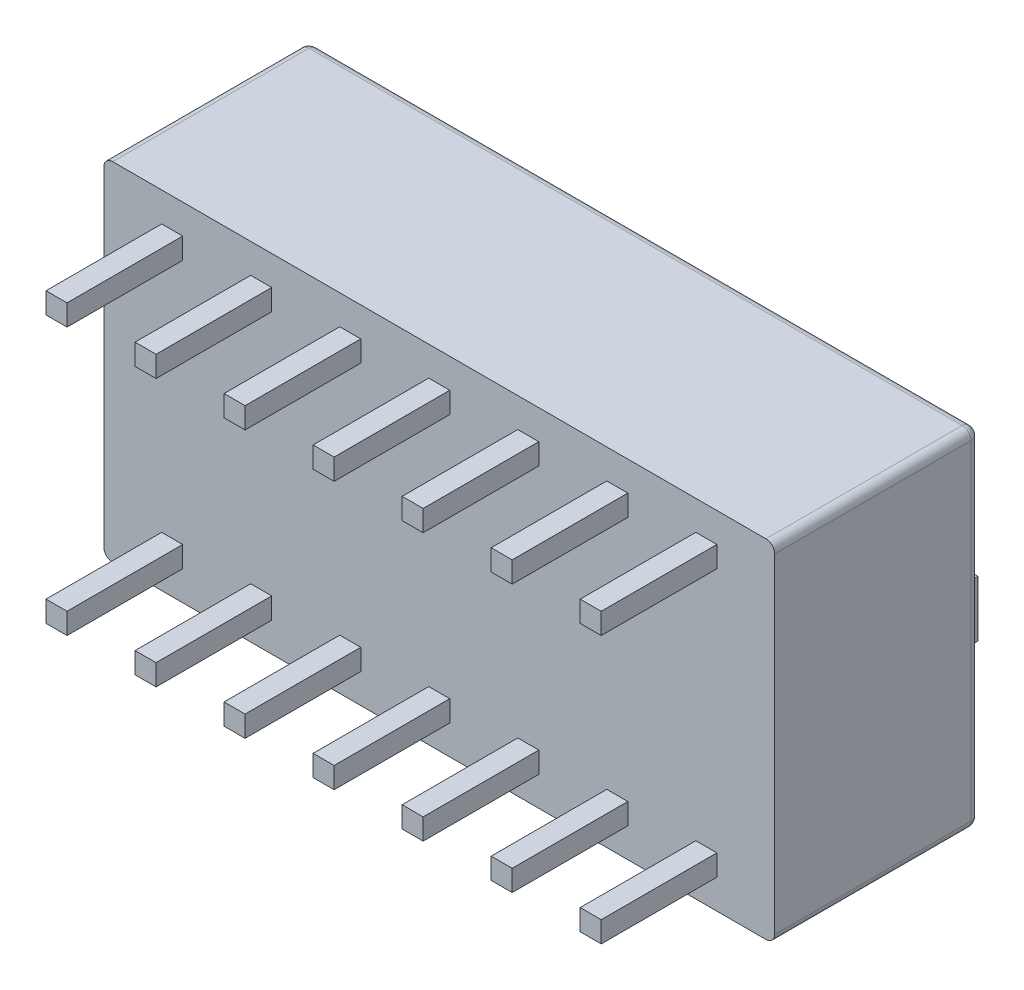
from build123d import *

# Parameters (mm, degrees)
IZIM1_W                       = 19.14
IZIM1_H                       = 9.9
Y_KSEKLIK_EKSTR_ZYON1_DEPTH   = 5.85
IZIM2_W                       = 1.4
IZIM2_H                       = 3.2
KES_EKSTR_ZYON1_DEPTH         = 1
IZIM3_W                       = 1.4
IZIM3_H                       = 1.6
Y_KSEKLIK_EKSTR_ZYON2_DEPTH   = 2.2
Y_KSEKLIK_EKSTR_ZYON2_2_DEPTH = 2.2
Y_KSEKLIK_EKSTR_ZYON2_3_DEPTH = 2.2
Y_KSEKLIK_EKSTR_ZYON2_4_DEPTH = 2.2
Y_KSEKLIK_EKSTR_ZYON2_5_DEPTH = 2.2
Y_KSEKLIK_EKSTR_ZYON2_6_DEPTH = 2.2
Y_KSEKLIK_EKSTR_ZYON2_7_DEPTH = 2.2
IZIM4_W                       = 1.4
IZIM4_H                       = 1.6
Y_KSEKLIK_EKSTR_ZYON3_DEPTH   = 0.9
Y_KSEKLIK_EKSTR_ZYON3_2_DEPTH = 0.9
Y_KSEKLIK_EKSTR_ZYON3_3_DEPTH = 0.9
Y_KSEKLIK_EKSTR_ZYON3_4_DEPTH = 0.9
Y_KSEKLIK_EKSTR_ZYON3_5_DEPTH = 0.9
Y_KSEKLIK_EKSTR_ZYON3_6_DEPTH = 0.9
Y_KSEKLIK_EKSTR_ZYON3_7_DEPTH = 0.9
RADYUS1_R                     = 0.25
IZIM5_W                       = 0.6
IZIM5_H                       = 0.6
Y_KSEKLIK_EKSTR_ZYON4_DEPTH   = 3.3


with BuildPart() as part:
    # Çizim1 → Yükseklik-Ekstrüzyon1 (new body)
    with BuildSketch(Plane.XY):
        Rectangle(IZIM1_W, IZIM1_H)
    extrude(amount=Y_KSEKLIK_EKSTR_ZYON1_DEPTH)

    # Çizim2 → Kes-Ekstrüzyon1 (cut)
    with BuildSketch(Plane(origin=(0, 0, 0), x_dir=(-1, 0, 0), z_dir=(0, 0, -1))):
        with Locations((-7.62, 0)):
            Rectangle(IZIM2_W, IZIM2_H)
        with Locations((-5.08, 0)):
            Rectangle(IZIM2_W, IZIM2_H)
        with Locations((-2.54, 0)):
            Rectangle(IZIM2_W, IZIM2_H)
        Rectangle(IZIM2_W, IZIM2_H)
        with Locations((2.54, 0)):
            Rectangle(IZIM2_W, IZIM2_H)
        with Locations((5.08, 0)):
            Rectangle(IZIM2_W, IZIM2_H)
        with Locations((7.62, 0)):
            Rectangle(IZIM2_W, IZIM2_H)
    extrude(amount=-KES_EKSTR_ZYON1_DEPTH, mode=Mode.SUBTRACT)

    # Radyus1
    radyus1_edges = [part.edges().sort_by_distance(p)[0] for p in [
        (0, -4.95, 0),
        (-9.57, 0, 0),
        (0, 4.95, 0),
        (9.57, 0, 0),
        (9.57, -4.95, 2.925),
        (-9.57, -4.95, 2.925),
        (-9.57, 4.95, 2.925),
        (9.57, 4.95, 2.925),
    ]]
    fillet(radyus1_edges, radius=RADYUS1_R)

    # Çizim5 → Yükseklik-Ekstrüzyon4 (add)
    with BuildSketch(Plane.XY.offset(5.85)):
        with Locations((-7.62, 3.81)):
            Rectangle(IZIM5_W, IZIM5_H)
        with Locations((-5.08, 3.81)):
            Rectangle(IZIM5_W, IZIM5_H)
        with Locations((-2.54, 3.81)):
            Rectangle(IZIM5_W, IZIM5_H)
        with Locations((0, 3.81)):
            Rectangle(IZIM5_W, IZIM5_H)
        with Locations((2.54, 3.81)):
            Rectangle(IZIM5_W, IZIM5_H)
        with Locations((5.08, 3.81)):
            Rectangle(IZIM5_W, IZIM5_H)
        with Locations((7.62, 3.81)):
            Rectangle(IZIM5_W, IZIM5_H)
        with Locations((7.62, -3.81)):
            Rectangle(IZIM5_W, IZIM5_H)
        with Locations((5.08, -3.81)):
            Rectangle(IZIM5_W, IZIM5_H)
        with Locations((2.54, -3.81)):
            Rectangle(IZIM5_W, IZIM5_H)
        with Locations((0, -3.81)):
            Rectangle(IZIM5_W, IZIM5_H)
        with Locations((-2.54, -3.81)):
            Rectangle(IZIM5_W, IZIM5_H)
        with Locations((-5.08, -3.81)):
            Rectangle(IZIM5_W, IZIM5_H)
        with Locations((-7.62, -3.81)):
            Rectangle(IZIM5_W, IZIM5_H)
    extrude(amount=Y_KSEKLIK_EKSTR_ZYON4_DEPTH)


with BuildPart() as body_2:
    # Çizim3 → Yükseklik-Ekstrüzyon2 (new body)
    with BuildSketch(Plane(origin=(0, 0, 1), x_dir=(-1, 0, 0), z_dir=(0, 0, -1))):
        with Locations((-7.62, -0.8)):
            Rectangle(IZIM3_W, IZIM3_H)
    extrude(amount=Y_KSEKLIK_EKSTR_ZYON2_DEPTH)


with BuildPart() as body_3:
    # Çizim3 → Y_kseklik-Ekstr_zyon2 2 (new body)
    with BuildSketch(Plane(origin=(0, 0, 1), x_dir=(-1, 0, 0), z_dir=(0, 0, -1))):
        with Locations((-5.08, -0.8)):
            Rectangle(IZIM3_W, IZIM3_H)
    extrude(amount=Y_KSEKLIK_EKSTR_ZYON2_2_DEPTH)


with BuildPart() as body_4:
    # Çizim3 → Y_kseklik-Ekstr_zyon2 3 (new body)
    with BuildSketch(Plane(origin=(0, 0, 1), x_dir=(-1, 0, 0), z_dir=(0, 0, -1))):
        with Locations((-2.54, -0.8)):
            Rectangle(IZIM3_W, IZIM3_H)
    extrude(amount=Y_KSEKLIK_EKSTR_ZYON2_3_DEPTH)


with BuildPart() as body_5:
    # Çizim3 → Y_kseklik-Ekstr_zyon2 4 (new body)
    with BuildSketch(Plane(origin=(0, 0, 1), x_dir=(-1, 0, 0), z_dir=(0, 0, -1))):
        with Locations((0, -0.8)):
            Rectangle(IZIM3_W, IZIM3_H)
    extrude(amount=Y_KSEKLIK_EKSTR_ZYON2_4_DEPTH)


with BuildPart() as body_6:
    # Çizim3 → Y_kseklik-Ekstr_zyon2 5 (new body)
    with BuildSketch(Plane(origin=(0, 0, 1), x_dir=(-1, 0, 0), z_dir=(0, 0, -1))):
        with Locations((2.54, -0.8)):
            Rectangle(IZIM3_W, IZIM3_H)
    extrude(amount=Y_KSEKLIK_EKSTR_ZYON2_5_DEPTH)


with BuildPart() as body_7:
    # Çizim3 → Y_kseklik-Ekstr_zyon2 6 (new body)
    with BuildSketch(Plane(origin=(0, 0, 1), x_dir=(-1, 0, 0), z_dir=(0, 0, -1))):
        with Locations((5.08, -0.8)):
            Rectangle(IZIM3_W, IZIM3_H)
    extrude(amount=Y_KSEKLIK_EKSTR_ZYON2_6_DEPTH)


with BuildPart() as body_8:
    # Çizim3 → Y_kseklik-Ekstr_zyon2 7 (new body)
    with BuildSketch(Plane(origin=(0, 0, 1), x_dir=(-1, 0, 0), z_dir=(0, 0, -1))):
        with Locations((7.62, -0.8)):
            Rectangle(IZIM3_W, IZIM3_H)
    extrude(amount=Y_KSEKLIK_EKSTR_ZYON2_7_DEPTH)


with BuildPart() as body_9:
    # Çizim4 → Yükseklik-Ekstrüzyon3 (new body)
    with BuildSketch(Plane(origin=(0, 0, 1), x_dir=(-1, 0, 0), z_dir=(0, 0, -1))):
        with Locations((-7.62, 0.8)):
            Rectangle(IZIM4_W, IZIM4_H)
    extrude(amount=Y_KSEKLIK_EKSTR_ZYON3_DEPTH)


with BuildPart() as body_10:
    # Çizim4 → Y_kseklik-Ekstr_zyon3 2 (new body)
    with BuildSketch(Plane(origin=(0, 0, 1), x_dir=(-1, 0, 0), z_dir=(0, 0, -1))):
        with Locations((-5.08, 0.8)):
            Rectangle(IZIM4_W, IZIM4_H)
    extrude(amount=Y_KSEKLIK_EKSTR_ZYON3_2_DEPTH)


with BuildPart() as body_11:
    # Çizim4 → Y_kseklik-Ekstr_zyon3 3 (new body)
    with BuildSketch(Plane(origin=(0, 0, 1), x_dir=(-1, 0, 0), z_dir=(0, 0, -1))):
        with Locations((-2.54, 0.8)):
            Rectangle(IZIM4_W, IZIM4_H)
    extrude(amount=Y_KSEKLIK_EKSTR_ZYON3_3_DEPTH)


with BuildPart() as body_12:
    # Çizim4 → Y_kseklik-Ekstr_zyon3 4 (new body)
    with BuildSketch(Plane(origin=(0, 0, 1), x_dir=(-1, 0, 0), z_dir=(0, 0, -1))):
        with Locations((0, 0.8)):
            Rectangle(IZIM4_W, IZIM4_H)
    extrude(amount=Y_KSEKLIK_EKSTR_ZYON3_4_DEPTH)


with BuildPart() as body_13:
    # Çizim4 → Y_kseklik-Ekstr_zyon3 5 (new body)
    with BuildSketch(Plane(origin=(0, 0, 1), x_dir=(-1, 0, 0), z_dir=(0, 0, -1))):
        with Locations((2.54, 0.8)):
            Rectangle(IZIM4_W, IZIM4_H)
    extrude(amount=Y_KSEKLIK_EKSTR_ZYON3_5_DEPTH)


with BuildPart() as body_14:
    # Çizim4 → Y_kseklik-Ekstr_zyon3 6 (new body)
    with BuildSketch(Plane(origin=(0, 0, 1), x_dir=(-1, 0, 0), z_dir=(0, 0, -1))):
        with Locations((5.08, 0.8)):
            Rectangle(IZIM4_W, IZIM4_H)
    extrude(amount=Y_KSEKLIK_EKSTR_ZYON3_6_DEPTH)


with BuildPart() as body_15:
    # Çizim4 → Y_kseklik-Ekstr_zyon3 7 (new body)
    with BuildSketch(Plane(origin=(0, 0, 1), x_dir=(-1, 0, 0), z_dir=(0, 0, -1))):
        with Locations((7.62, 0.8)):
            Rectangle(IZIM4_W, IZIM4_H)
    extrude(amount=Y_KSEKLIK_EKSTR_ZYON3_7_DEPTH)


solid = Compound([part.part, body_2.part, body_3.part, body_4.part, body_5.part, body_6.part, body_7.part, body_8.part, body_9.part, body_10.part, body_11.part, body_12.part, body_13.part, body_14.part, body_15.part])
